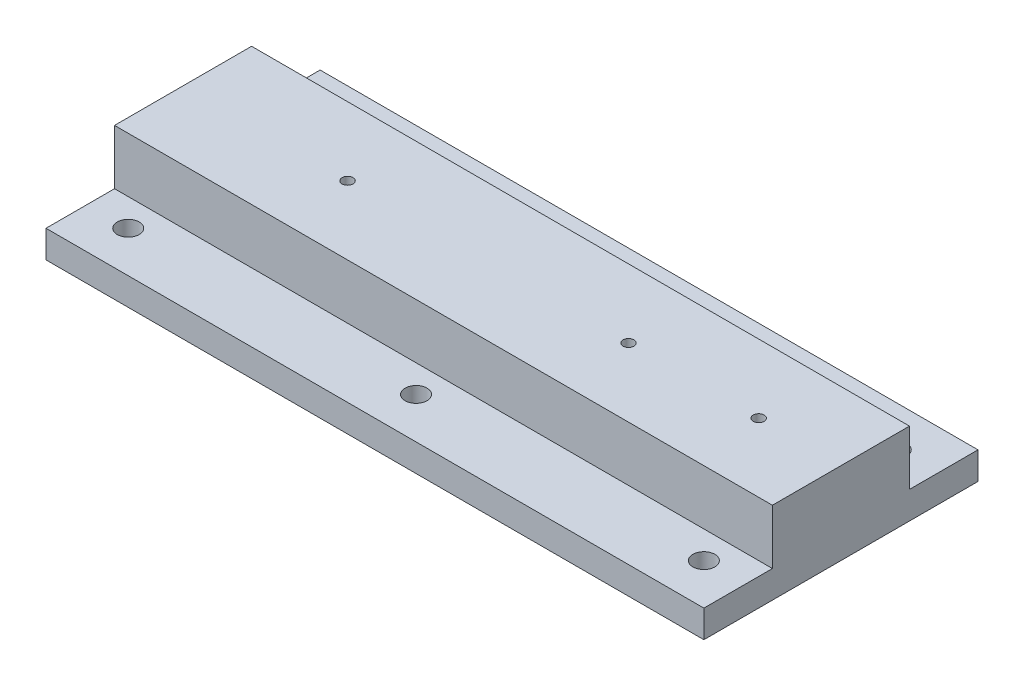
from build123d import *

# Parameters (mm, degrees)
SKETCH2_W                       = 120
SKETCH2_H                       = 50
BOSS_EXTRUDE1_DEPTH             = 15
AUFSATZ_LINEAR_START            = 47.5
AUFSATZ_LINEAR_AUSTRAGEN3_DEPTH = 47.5
SCHNITT_LINEAR_START            = 35
SKIZZE7_R                       = 7.5
SCHNITT_LINEAR_AUSTRAGEN2_DEPTH = 12.5
SCHNITT_LINEAR_START_2          = 10
SKIZZE7_2_R                     = 7.5
SCHNITT_LINEAR_AUSTRAGEN3_DEPTH = 10
SCHNITT_LINEAR_AUSTRAGEN4_REACH = 84.234
SKIZZE8_R                       = 1
SCHNITT_LINEAR_AUSTRAGEN5_DEPTH = 126.77149982
SKIZZE10_R                      = 2
SCHNITT_LINEAR_AUSTRAGEN7_DEPTH = 82.469960946
SPIEGELN3_COPY_1_SKETCH_R       = 2
SPIEGELN3_COPY_1_DEPTH          = 82.469960946
SKIZZE12_R                      = 2
SCHNITT_LINEAR_AUSTRAGEN8_DEPTH = 10


with BuildPart() as part:
    # Sketch2 → Boss-Extrude1 (new body)
    with BuildSketch(Plane(origin=(0, 0, 0), x_dir=(1, 0, 0), z_dir=(0, 1, 0))):
        with Locations((13.101876656, 9.54663752)):
            Rectangle(SKETCH2_W, SKETCH2_H)
    extrude(amount=BOSS_EXTRUDE1_DEPTH)

    # Sketch3 → Cut-Revolve8 (revolve, cut)
    with BuildSketch(Plane(origin=(0, 0, 0), x_dir=(1, 0, 0), z_dir=(0, 1, 0))):
        Polygon((63.101876656, 9.54663752), (63.101876656, 17.04663752), (3.101876656, 17.04663752), (3.101876656, 19.54663752), (-36.898123344, 19.54663752), (-36.898123344, 9.54663752), align=None)
    revolve(axis=Axis((74.354835368, 0, -9.54663752), (-1, 0, 0)), mode=Mode.SUBTRACT)

    # Skizze2 → Aufsatz-Linear austragen3 (add)
    with BuildSketch(Plane.ZY.offset(-63.101876656).offset(AUFSATZ_LINEAR_START)):
        with BuildLine():
            Line((-3.54663752, 0), (-2.04663752, 0))
            ThreePointArc((-2.04663752, 0), (-2.491532858, 2.544700024), (-3.773437043, 4.7875))
            Line((-3.773437043, 4.7875), (-4.928077138, 3.83))
            ThreePointArc((-4.928077138, 3.83), (-3.902553791, 2.035760019), (-3.54663752, 0))
        make_face()
    aufsatz_linear_austragen3 = extrude(amount=-AUFSATZ_LINEAR_AUSTRAGEN3_DEPTH)

    # Spiegeln1: Aufsatz-Linear austragen3 across plane
    add(aufsatz_linear_austragen3.mirror(Plane.XY.offset(-9.54663752)))

    # Skizze7 → Schnitt-Linear austragen2 (cut)
    with BuildSketch(Plane.ZY.offset(-63.101876656).offset(SCHNITT_LINEAR_START)):
        with Locations((-9.54663752, 0)):
            Circle(SKIZZE7_R)
    extrude(amount=-SCHNITT_LINEAR_AUSTRAGEN2_DEPTH, mode=Mode.SUBTRACT)

    # Skizze7<2> → Schnitt-Linear austragen3 (cut)
    with BuildSketch(Plane.ZY.offset(-63.101876656).offset(SCHNITT_LINEAR_START_2)):
        with Locations((-9.54663752, 0)):
            Circle(SKIZZE7_2_R)
    extrude(amount=-SCHNITT_LINEAR_AUSTRAGEN3_DEPTH, mode=Mode.SUBTRACT)

    # Skizze8 → Schnitt-Linear austragen4 (cut, up to next)
    with BuildSketch(Plane(origin=(0, 15, 0), x_dir=(1, 0, 0), z_dir=(0, 1, 0)), mode=Mode.PRIVATE) as schnitt_linear_austragen4_sk1:
        with Locations(Location((58.101876656, 9.54663752, 0), (0, 0, 270))):
            Circle(SKIZZE8_R)
    schnitt_linear_austragen4_tool1 = extrude(schnitt_linear_austragen4_sk1.sketch, amount=-SCHNITT_LINEAR_AUSTRAGEN4_REACH, mode=Mode.PRIVATE) & part.part
    # Skizze8 → Schnitt-Linear austragen4 (cut, up to next)
    with BuildSketch(Plane(origin=(0, 15, 0), x_dir=(1, 0, 0), z_dir=(0, 1, 0)), mode=Mode.PRIVATE) as schnitt_linear_austragen4_sk2:
        with Locations(Location((34.351876656, 9.54663752, 0), (0, 0, 270))):
            Circle(SKIZZE8_R)
    schnitt_linear_austragen4_tool2 = extrude(schnitt_linear_austragen4_sk2.sketch, amount=-SCHNITT_LINEAR_AUSTRAGEN4_REACH, mode=Mode.PRIVATE) & part.part
    # Skizze8 → Schnitt-Linear austragen4 (cut, up to next)
    with BuildSketch(Plane(origin=(0, 15, 0), x_dir=(1, 0, 0), z_dir=(0, 1, 0)), mode=Mode.PRIVATE) as schnitt_linear_austragen4_sk3:
        with Locations(Location((-16.898123344, 9.54663752, 0), (0, 0, 270))):
            Circle(SKIZZE8_R)
    schnitt_linear_austragen4_tool3 = extrude(schnitt_linear_austragen4_sk3.sketch, amount=-SCHNITT_LINEAR_AUSTRAGEN4_REACH, mode=Mode.PRIVATE) & part.part
    add(schnitt_linear_austragen4_tool1.solids().sort_by_distance((58.101877, 15, -9.546638))[0], mode=Mode.SUBTRACT)
    add(schnitt_linear_austragen4_tool2.solids().sort_by_distance((34.351877, 15, -9.546638))[0], mode=Mode.SUBTRACT)
    add(schnitt_linear_austragen4_tool3.solids().sort_by_distance((-16.898123, 15, -9.546638))[0], mode=Mode.SUBTRACT)

    # Skizze9 → Schnitt-Linear austragen5 (cut, through all)
    with BuildSketch(Plane.ZY.offset(46.898123344)):
        Polygon((-34.54663752, 5), (-22.04663752, 5), (-22.04663752, 15), (2.95336248, 15), (2.95336248, 5), (15.45336248, 5), (15.45336248, 15), (-34.54663752, 15), align=None)
    extrude(amount=-SCHNITT_LINEAR_AUSTRAGEN5_DEPTH, mode=Mode.SUBTRACT)

    # Skizze10 → Schnitt-Linear austragen7 (cut, through all)
    with BuildSketch(Plane(origin=(0, 5, 0), x_dir=(1, 0, 0), z_dir=(0, 1, 0))):
        with Locations(Location((65.601876656, 27.04663752, 0), (0, 0, 270))):
            Circle(SKIZZE10_R)
    schnitt_linear_austragen7 = extrude(amount=-SCHNITT_LINEAR_AUSTRAGEN7_DEPTH, mode=Mode.SUBTRACT)

    # Spiegeln2: Schnitt-Linear austragen7 across plane
    add(schnitt_linear_austragen7.mirror(Plane.XY.offset(-9.54663752)), mode=Mode.SUBTRACT)

    # Spiegeln3: Schnitt-Linear austragen7 across plane
    add(schnitt_linear_austragen7.mirror(Plane(origin=(13.101876656, 0, 0), x_dir=(0, 0, 1), z_dir=(1, 0, 0))), mode=Mode.SUBTRACT)

    # Spiegeln3 copy 1 sketch → Spiegeln3 copy 1 (cut, through all)
    with BuildSketch(Plane(origin=(26.203753312, 5, -19.09327504), x_dir=(-1, 0, 0), z_dir=(0, 1, 0))):
        with Locations(Location((65.601876656, 27.04663752, 0), (0, 0, 270))):
            Circle(SPIEGELN3_COPY_1_SKETCH_R)
    extrude(amount=-SPIEGELN3_COPY_1_DEPTH, mode=Mode.SUBTRACT)

    # Skizze12 → Schnitt-Linear austragen8 (cut)
    with BuildSketch(Plane(origin=(0, 5, 0), x_dir=(1, 0, 0), z_dir=(0, 1, 0))):
        with Locations(Location((13.101876656, 27.04663752, 0), (0, 0, 270))):
            Circle(SKIZZE12_R)
        with Locations(Location((13.101876656, -7.95336248, 0), (0, 0, 270))):
            Circle(SKIZZE12_R)
    extrude(amount=-SCHNITT_LINEAR_AUSTRAGEN8_DEPTH, mode=Mode.SUBTRACT)


solid = part.part
